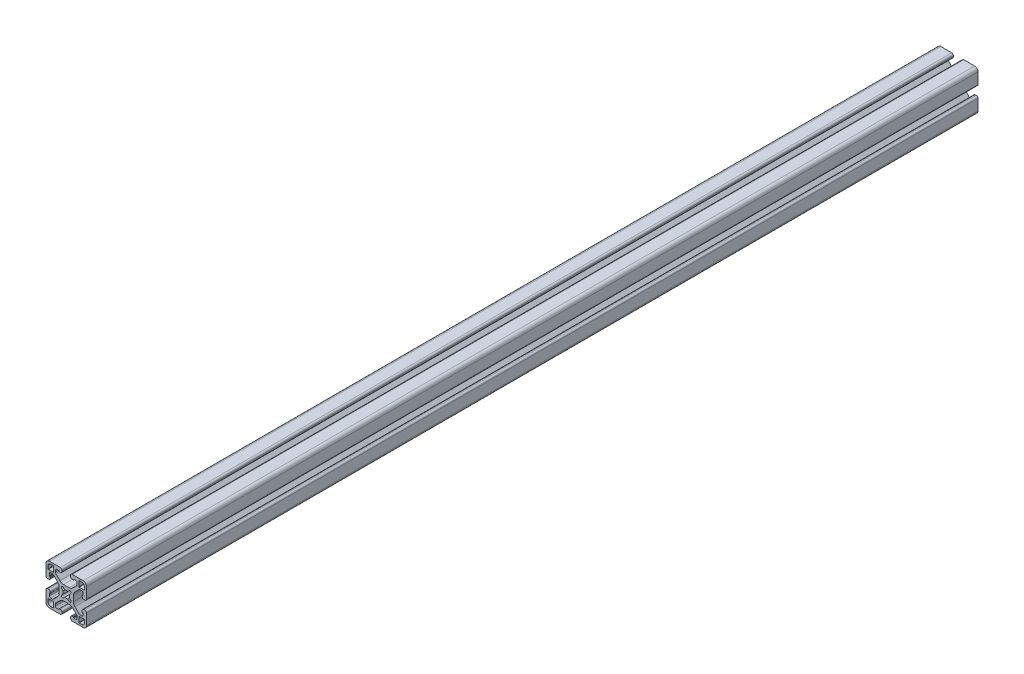
from build123d import *

# Parameters (mm, degrees)
EXTRUDE1_DEPTH = 838.2


with BuildPart() as part:
    # Sketch1 → Extrude1 (new body)
    with BuildSketch(Plane.XY):
        with BuildLine():
            Line((-46.536752228, -7.000622168), (-46.536752228, -8.774580164))
            ThreePointArc((-46.536752228, -8.774580164), (-46.907290083, -9.675221514), (-47.806745776, -10.048628264))
            Line((-47.806745776, -10.048628264), (-49.392633083, -10.048628264))
            ThreePointArc((-49.392633083, -10.048628264), (-49.878641042, -9.95195527), (-50.290658695, -9.676653876))
            Line((-50.290658695, -9.676653876), (-54.238761565, -5.728551005))
            ThreePointArc((-54.238761565, -5.728551005), (-55.26838878, -4.187604983), (-55.629945776, -2.369935216))
            Line((-55.629945776, -2.369935216), (-55.629945776, 2.846678689))
            ThreePointArc((-55.629945776, 2.846678689), (-55.26838878, 4.664348456), (-54.238761565, 6.205294478))
            Line((-54.238761565, 6.205294478), (-50.290658695, 10.153397348))
            ThreePointArc((-50.290658695, 10.153397348), (-49.878641042, 10.428698742), (-49.392633083, 10.525371736))
            Line((-49.392633083, 10.525371736), (-47.806745776, 10.525371736))
            ThreePointArc((-47.806745776, 10.525371736), (-46.907290079, 10.151964982), (-46.536752228, 9.251323623))
            Line((-46.536752228, 9.251323623), (-46.536752228, 7.47736564))
            ThreePointArc((-46.536752228, 7.47736564), (-46.648344767, 7.207957418), (-46.91775299, 7.096364878))
            Line((-46.91775299, 7.096364878), (-46.993953142, 7.096364878))
            ThreePointArc((-46.993953142, 7.096364878), (-47.263362671, 6.984771032), (-47.374953904, 6.715360422))
            Line((-47.374953904, 6.715360422), (-47.374945776, 5.877156465))
            ThreePointArc((-47.374945776, 5.877156465), (-46.913692136, 4.763614578), (-45.800145776, 4.302371736))
            Line((-45.800145776, 4.302371736), (-44.885745776, 4.302371736))
            ThreePointArc((-44.885745776, 4.302371736), (-43.772194017, 4.763619977), (-43.310945776, 5.877171736))
            Line((-43.310945776, 5.877171736), (-43.310945776, 16.113371736))
            ThreePointArc((-43.310945776, 16.113371736), (-44.240881746, 18.358435766), (-46.485945776, 19.288371736))
            Line((-46.485945776, 19.288371736), (-56.722145776, 19.288371736))
            ThreePointArc((-56.722145776, 19.288371736), (-57.835697535, 18.827123495), (-58.296945776, 17.713571736))
            Line((-58.296945776, 17.713571736), (-58.296945776, 16.799171736))
            ThreePointArc((-58.296945776, 16.799171736), (-57.835702934, 15.685625376), (-56.722161047, 15.224371736))
            Line((-56.722161047, 15.224371736), (-55.883957091, 15.224363608))
            ThreePointArc((-55.883957091, 15.224363608), (-55.61454648, 15.335954841), (-55.502952634, 15.60536437))
            Line((-55.502952634, 15.60536437), (-55.502952634, 15.681564523))
            ThreePointArc((-55.502952634, 15.681564523), (-55.391360095, 15.950972745), (-55.121951872, 16.062565285))
            Line((-55.121951872, 16.062565285), (-53.347993876, 16.062565285))
            ThreePointArc((-53.347993876, 16.062565285), (-52.447352526, 15.692027429), (-52.073945776, 14.792571736))
            Line((-52.073945776, 14.792571736), (-52.073945776, 13.206684429))
            ThreePointArc((-52.073945776, 13.206684429), (-52.17061877, 12.72067647), (-52.445920164, 12.308658817))
            Line((-52.445920164, 12.308658817), (-56.394023034, 8.360555947))
            ThreePointArc((-56.394023034, 8.360555947), (-57.934969057, 7.330928733), (-59.752638824, 6.969371736))
            Line((-59.752638824, 6.969371736), (-64.969252728, 6.969371736))
            ThreePointArc((-64.969252728, 6.969371736), (-66.786922496, 7.330928733), (-68.327868518, 8.360555947))
            Line((-68.327868518, 8.360555947), (-72.275971388, 12.308658817))
            ThreePointArc((-72.275971388, 12.308658817), (-72.551272782, 12.72067647), (-72.647945776, 13.206684429))
            Line((-72.647945776, 13.206684429), (-72.647945776, 14.792571736))
            ThreePointArc((-72.647945776, 14.792571736), (-72.274539022, 15.692027434), (-71.373897663, 16.062565285))
            Line((-71.373897663, 16.062565285), (-69.59993968, 16.062565285))
            ThreePointArc((-69.59993968, 16.062565285), (-69.330531458, 15.950972745), (-69.218938918, 15.681564523))
            Line((-69.218938918, 15.681564523), (-69.218938918, 15.60536437))
            ThreePointArc((-69.218938918, 15.60536437), (-69.107345072, 15.335954841), (-68.837934461, 15.224363608))
            Line((-68.837934461, 15.224363608), (-67.999730505, 15.224371736))
            ThreePointArc((-67.999730505, 15.224371736), (-66.886188618, 15.685625376), (-66.424945776, 16.799171736))
            Line((-66.424945776, 16.799171736), (-66.424945776, 17.713571736))
            ThreePointArc((-66.424945776, 17.713571736), (-66.886194017, 18.827123495), (-67.999745776, 19.288371736))
            Line((-67.999745776, 19.288371736), (-78.235945776, 19.288371736))
            ThreePointArc((-78.235945776, 19.288371736), (-80.481009806, 18.358435766), (-81.410945776, 16.113371736))
            Line((-81.410945776, 16.113371736), (-81.410945776, 5.877171736))
            ThreePointArc((-81.410945776, 5.877171736), (-80.949697535, 4.763619977), (-79.836145776, 4.302371736))
            Line((-79.836145776, 4.302371736), (-78.921745776, 4.302371736))
            ThreePointArc((-78.921745776, 4.302371736), (-77.808199416, 4.763614578), (-77.346945776, 5.877156465))
            Line((-77.346945776, 5.877156465), (-77.346937648, 6.715360422))
            ThreePointArc((-77.346937648, 6.715360422), (-77.458528881, 6.984771032), (-77.72793841, 7.096364878))
            Line((-77.72793841, 7.096364878), (-77.804138562, 7.096364878))
            ThreePointArc((-77.804138562, 7.096364878), (-78.073546785, 7.207957418), (-78.185139324, 7.47736564))
            Line((-78.185139324, 7.47736564), (-78.185139324, 9.251323637))
            ThreePointArc((-78.185139324, 9.251323637), (-77.814601469, 10.151964987), (-76.915145776, 10.525371736))
            Line((-76.915145776, 10.525371736), (-75.329258469, 10.525371736))
            ThreePointArc((-75.329258469, 10.525371736), (-74.84325051, 10.428698742), (-74.431232857, 10.153397348))
            Line((-74.431232857, 10.153397348), (-70.483129987, 6.205294478))
            ThreePointArc((-70.483129987, 6.205294478), (-69.453502773, 4.664348456), (-69.091945776, 2.846678689))
            Line((-69.091945776, 2.846678689), (-69.091945776, -2.369935216))
            ThreePointArc((-69.091945776, -2.369935216), (-69.453502773, -4.187604983), (-70.483129987, -5.728551005))
            Line((-70.483129987, -5.728551005), (-74.431232857, -9.676653876))
            ThreePointArc((-74.431232857, -9.676653876), (-74.84325051, -9.95195527), (-75.329258469, -10.048628264))
            Line((-75.329258469, -10.048628264), (-76.915145776, -10.048628264))
            ThreePointArc((-76.915145776, -10.048628264), (-77.814601474, -9.67522151), (-78.185139324, -8.774580151))
            Line((-78.185139324, -8.774580151), (-78.185139324, -7.000622168))
            ThreePointArc((-78.185139324, -7.000622168), (-78.073546785, -6.731213945), (-77.804138562, -6.619621406))
            Line((-77.804138562, -6.619621406), (-77.72793841, -6.619621406))
            ThreePointArc((-77.72793841, -6.619621406), (-77.458528881, -6.50802756), (-77.346937648, -6.238616949))
            Line((-77.346937648, -6.238616949), (-77.346945776, -5.400412993))
            ThreePointArc((-77.346945776, -5.400412993), (-77.808199416, -4.286871106), (-78.921745776, -3.825628264))
            Line((-78.921745776, -3.825628264), (-79.836145776, -3.825628264))
            ThreePointArc((-79.836145776, -3.825628264), (-80.949697535, -4.286876505), (-81.410945776, -5.400428264))
            Line((-81.410945776, -5.400428264), (-81.410945776, -15.636628264))
            ThreePointArc((-81.410945776, -15.636628264), (-80.481009806, -17.881692294), (-78.235945776, -18.811628264))
            Line((-78.235945776, -18.811628264), (-67.999745776, -18.811628264))
            ThreePointArc((-67.999745776, -18.811628264), (-66.886194017, -18.350380023), (-66.424945776, -17.236828264))
            Line((-66.424945776, -17.236828264), (-66.424945776, -16.322428264))
            ThreePointArc((-66.424945776, -16.322428264), (-66.886188618, -15.208881904), (-67.999730505, -14.747628264))
            Line((-67.999730505, -14.747628264), (-68.837934461, -14.747620136))
            ThreePointArc((-68.837934461, -14.747620136), (-69.107345072, -14.859211369), (-69.218938918, -15.128620898))
            Line((-69.218938918, -15.128620898), (-69.218938918, -15.20482105))
            ThreePointArc((-69.218938918, -15.20482105), (-69.330531458, -15.474229273), (-69.59993968, -15.585821812))
            Line((-69.59993968, -15.585821812), (-71.373897676, -15.585821812))
            ThreePointArc((-71.373897676, -15.585821812), (-72.274539027, -15.215283957), (-72.647945776, -14.315828264))
            Line((-72.647945776, -14.315828264), (-72.647945776, -12.729940957))
            ThreePointArc((-72.647945776, -12.729940957), (-72.551272782, -12.243932998), (-72.275971388, -11.831915345))
            Line((-72.275971388, -11.831915345), (-68.327868518, -7.883812475))
            ThreePointArc((-68.327868518, -7.883812475), (-66.786922496, -6.85418526), (-64.969252728, -6.492628264))
            Line((-64.969252728, -6.492628264), (-59.752638824, -6.492628264))
            ThreePointArc((-59.752638824, -6.492628264), (-57.934969057, -6.85418526), (-56.394023034, -7.883812475))
            Line((-56.394023034, -7.883812475), (-52.445920164, -11.831915345))
            ThreePointArc((-52.445920164, -11.831915345), (-52.17061877, -12.243932998), (-52.073945776, -12.729940957))
            Line((-52.073945776, -12.729940957), (-52.073945776, -14.315828264))
            ThreePointArc((-52.073945776, -14.315828264), (-52.44735253, -15.215283961), (-53.347993889, -15.585821812))
            Line((-53.347993889, -15.585821812), (-55.121951872, -15.585821812))
            ThreePointArc((-55.121951872, -15.585821812), (-55.391360095, -15.474229273), (-55.502952634, -15.20482105))
            Line((-55.502952634, -15.20482105), (-55.502952634, -15.128620898))
            ThreePointArc((-55.502952634, -15.128620898), (-55.61454648, -14.859211369), (-55.883957091, -14.747620136))
            Line((-55.883957091, -14.747620136), (-56.722161047, -14.747628264))
            ThreePointArc((-56.722161047, -14.747628264), (-57.835702934, -15.208881904), (-58.296945776, -16.322428264))
            Line((-58.296945776, -16.322428264), (-58.296945776, -17.236828264))
            ThreePointArc((-58.296945776, -17.236828264), (-57.835697535, -18.350380023), (-56.722145776, -18.811628264))
            Line((-56.722145776, -18.811628264), (-46.485945776, -18.811628264))
            ThreePointArc((-46.485945776, -18.811628264), (-44.240881746, -17.881692294), (-43.310945776, -15.636628264))
            Line((-43.310945776, -15.636628264), (-43.310945776, -5.400428264))
            ThreePointArc((-43.310945776, -5.400428264), (-43.772194017, -4.286876505), (-44.885745776, -3.825628264))
            Line((-44.885745776, -3.825628264), (-45.800145776, -3.825628264))
            ThreePointArc((-45.800145776, -3.825628264), (-46.913692136, -4.286871106), (-47.374945776, -5.400412993))
            Line((-47.374945776, -5.400412993), (-47.374953904, -6.238616949))
            ThreePointArc((-47.374953904, -6.238616949), (-47.263362671, -6.50802756), (-46.993953142, -6.619621406))
            Line((-46.993953142, -6.619621406), (-46.91775299, -6.619621406))
            ThreePointArc((-46.91775299, -6.619621406), (-46.648344767, -6.731213945), (-46.536752228, -7.000622168))
        make_face()
        with BuildLine():
            Line((-66.704246649, -2.488483035), (-65.333825803, -1.118062189))
            ThreePointArc((-65.333825803, -1.118062189), (-65.628655776, 0.238371736), (-65.333825803, 1.594805661))
            Line((-65.333825803, 1.594805661), (-66.704246649, 2.965226507))
            ThreePointArc((-66.704246649, 2.965226507), (-66.704246649, 4.581672609), (-65.087800547, 4.581672609))
            Line((-65.087800547, 4.581672609), (-63.717379701, 3.211251763))
            ThreePointArc((-63.717379701, 3.211251763), (-62.360945776, 3.506081736), (-61.004511851, 3.211251763))
            Line((-61.004511851, 3.211251763), (-59.721184579, 4.483982556))
            ThreePointArc((-59.721184579, 4.483982556), (-58.017644903, 4.581672609), (-58.115334956, 2.878132934))
            Line((-58.115334956, 2.878132934), (-59.38806575, 1.594805661))
            ThreePointArc((-59.38806575, 1.594805661), (-59.093235776, 0.238371736), (-59.38806575, -1.118062189))
            Line((-59.38806575, -1.118062189), (-58.017644903, -2.488483035))
            ThreePointArc((-58.017644903, -2.488483035), (-58.017644903, -4.104929137), (-59.634091005, -4.104929137))
            Line((-59.634091005, -4.104929137), (-61.004511851, -2.73450829))
            ThreePointArc((-61.004511851, -2.73450829), (-62.360945776, -3.029338264), (-63.717379701, -2.73450829))
            Line((-63.717379701, -2.73450829), (-65.087800547, -4.104929137))
            ThreePointArc((-65.087800547, -4.104929137), (-66.704246649, -4.104929137), (-66.704246649, -2.488483035))
        make_face(mode=Mode.SUBTRACT)
        with BuildLine():
            Line((-79.607545776, 12.481171736), (-79.607545776, 14.690971736))
            ThreePointArc((-79.607545776, 14.690971736), (-78.789202123, 16.666628083), (-76.813545776, 17.484971736))
            Line((-76.813545776, 17.484971736), (-74.603745776, 17.484971736))
            ThreePointArc((-74.603745776, 17.484971736), (-74.334338092, 17.37337942), (-74.222745776, 17.103971736))
            Line((-74.222745776, 17.103971736), (-74.222745776, 12.481171736))
            ThreePointArc((-74.222745776, 12.481171736), (-74.334338092, 12.211764053), (-74.603745776, 12.100171736))
            Line((-74.603745776, 12.100171736), (-79.226545776, 12.100171736))
            ThreePointArc((-79.226545776, 12.100171736), (-79.49595346, 12.211764053), (-79.607545776, 12.481171736))
        make_face(mode=Mode.SUBTRACT)
        with BuildLine():
            Line((-74.603745776, -17.008228264), (-76.813545776, -17.008228264))
            ThreePointArc((-76.813545776, -17.008228264), (-78.789202123, -16.18988461), (-79.607545776, -14.214228264))
            Line((-79.607545776, -14.214228264), (-79.607545776, -12.004428264))
            ThreePointArc((-79.607545776, -12.004428264), (-79.49595346, -11.73502058), (-79.226545776, -11.623428264))
            Line((-79.226545776, -11.623428264), (-74.603745776, -11.623428264))
            ThreePointArc((-74.603745776, -11.623428264), (-74.334338092, -11.73502058), (-74.222745776, -12.004428264))
            Line((-74.222745776, -12.004428264), (-74.222745776, -16.627228264))
            ThreePointArc((-74.222745776, -16.627228264), (-74.334338092, -16.896635947), (-74.603745776, -17.008228264))
        make_face(mode=Mode.SUBTRACT)
        with BuildLine():
            Line((-45.114345776, -12.004428264), (-45.114345776, -14.214228264))
            ThreePointArc((-45.114345776, -14.214228264), (-45.932689429, -16.18988461), (-47.908345776, -17.008228264))
            Line((-47.908345776, -17.008228264), (-50.118145776, -17.008228264))
            ThreePointArc((-50.118145776, -17.008228264), (-50.38755346, -16.896635947), (-50.499145776, -16.627228264))
            Line((-50.499145776, -16.627228264), (-50.499145776, -12.004428264))
            ThreePointArc((-50.499145776, -12.004428264), (-50.38755346, -11.73502058), (-50.118145776, -11.623428264))
            Line((-50.118145776, -11.623428264), (-45.495345776, -11.623428264))
            ThreePointArc((-45.495345776, -11.623428264), (-45.225938092, -11.73502058), (-45.114345776, -12.004428264))
        make_face(mode=Mode.SUBTRACT)
        with BuildLine():
            Line((-50.118145776, 17.484971736), (-47.908345776, 17.484971736))
            ThreePointArc((-47.908345776, 17.484971736), (-45.932689429, 16.666628083), (-45.114345776, 14.690971736))
            Line((-45.114345776, 14.690971736), (-45.114345776, 12.481171736))
            ThreePointArc((-45.114345776, 12.481171736), (-45.225938092, 12.211764053), (-45.495345776, 12.100171736))
            Line((-45.495345776, 12.100171736), (-50.118145776, 12.100171736))
            ThreePointArc((-50.118145776, 12.100171736), (-50.38755346, 12.211764053), (-50.499145776, 12.481171736))
            Line((-50.499145776, 12.481171736), (-50.499145776, 17.103971736))
            ThreePointArc((-50.499145776, 17.103971736), (-50.38755346, 17.37337942), (-50.118145776, 17.484971736))
        make_face(mode=Mode.SUBTRACT)
    extrude(amount=-EXTRUDE1_DEPTH)


solid = part.part
